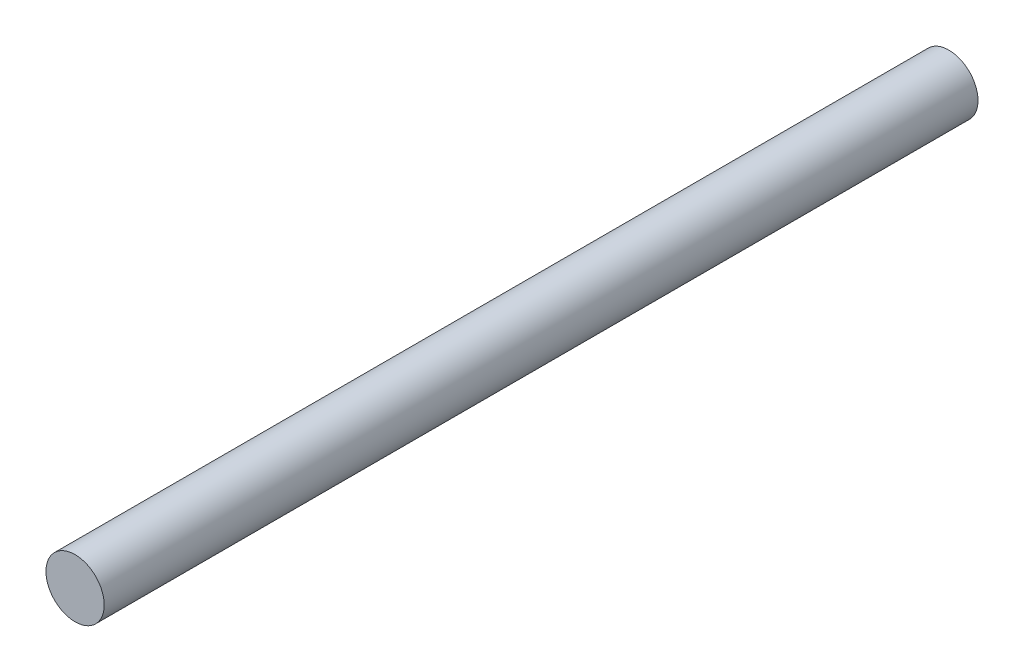
from build123d import *

# Parameters (mm, degrees)
CROQUIS1_R              = 4
SALIENTE_EXTRUIR1_DEPTH = 120


with BuildPart() as part:
    # Croquis1 → Saliente-Extruir1 (new body)
    with BuildSketch(Plane.XY):
        Circle(CROQUIS1_R)
    extrude(amount=SALIENTE_EXTRUIR1_DEPTH)


solid = part.part
